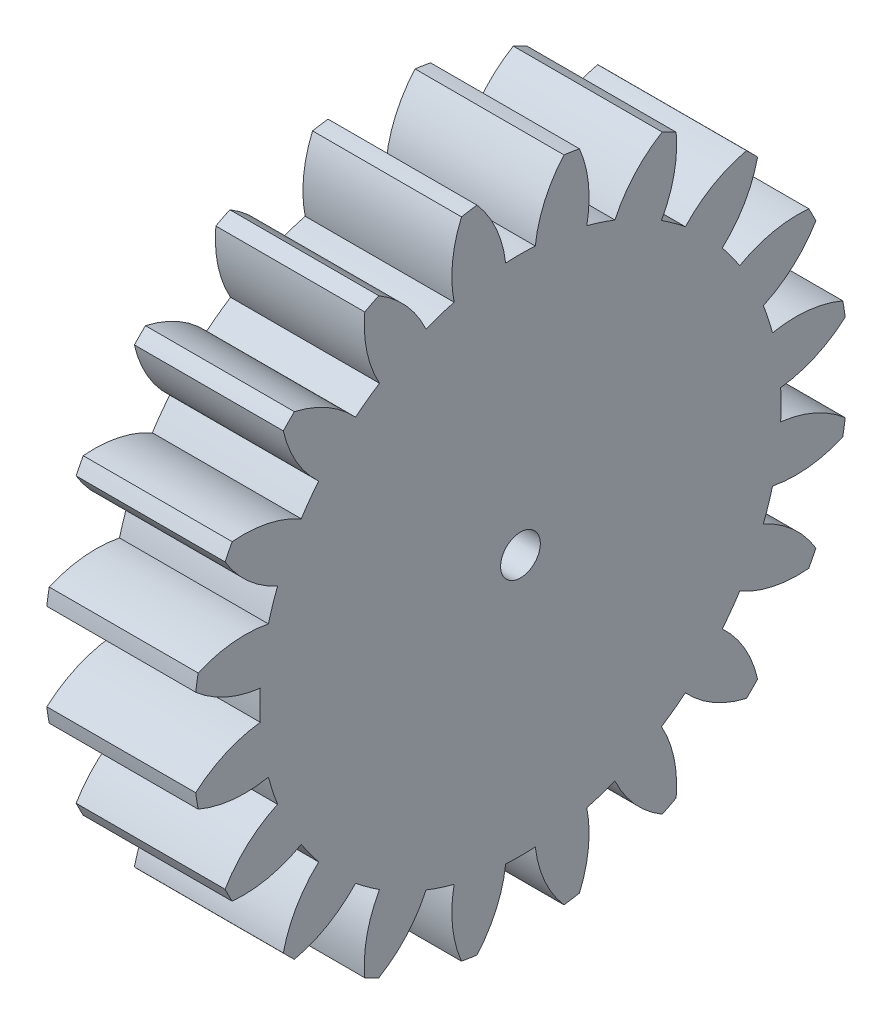
from build123d import *

# Parameters (mm, degrees)
BASPROSKE_W     = 15
BASPROSKE_H     = 33
TOOTHCUT_DEPTH  = 50.020403915
TEETHCUTS_COUNT = 20
TEETHCUTS_ANGLE = 342
BORSKE_R        = 2
BORE_DEPTH      = 50.0000508


with BuildPart() as part:
    # BasProSke → Base-Revolve (revolve)
    with BuildSketch(Plane(origin=(0, 0, 0), x_dir=(1, 0, 0), z_dir=(0, 1, 0)), mode=Mode.PRIVATE) as base_revolve_sk:
        with Locations((7.5, 16.5)):
            Rectangle(BASPROSKE_W, BASPROSKE_H)
    revolve(base_revolve_sk.sketch.rotate(Axis((-10, 0, 0), (1, 0, 0)), 180), axis=Axis((-10, 0, 0), (1, 0, 0)))

    # TooCutSke → ToothCut (cut, through all)
    with BuildSketch(Plane(origin=(0, 0, 0), x_dir=(0, 0, -1), z_dir=(1, 0, 0))):
        with BuildLine():
            ThreePointArc((1.489278925, 26.206717637), (0, 26.249), (-1.489278925, 26.206717637))
            ThreePointArc((-1.489278925, 26.206717637), (-2.448651415, 29.690511169), (-4.401620335, 32.730762038))
            ThreePointArc((-4.401620335, 32.730762038), (0, 33.0254), (4.401620335, 32.730762038))
            ThreePointArc((4.401620335, 32.730762038), (2.448651415, 29.690511169), (1.489278925, 26.206717637))
        make_face()
    toothcut = extrude(amount=TOOTHCUT_DEPTH, mode=Mode.SUBTRACT)

    # TeethCuts: ToothCut ×20 about axis
    teethcuts_axis = Axis((-10, 0, 0), (1, 0, 0))
    for i in range(1, TEETHCUTS_COUNT):
        add(toothcut.rotate(teethcuts_axis, i * TEETHCUTS_ANGLE / (TEETHCUTS_COUNT - 1)), mode=Mode.SUBTRACT)

    # BorSke → Bore (cut, symmetric)
    with BuildSketch(Plane(origin=(0, 0, 0), x_dir=(0, 0, -1), z_dir=(1, 0, 0))):
        with Locations(Location((0, 0, 0), (0, 0, 180))):
            Circle(BORSKE_R)
    extrude(amount=BORE_DEPTH, both=True, mode=Mode.SUBTRACT)


solid = part.part
